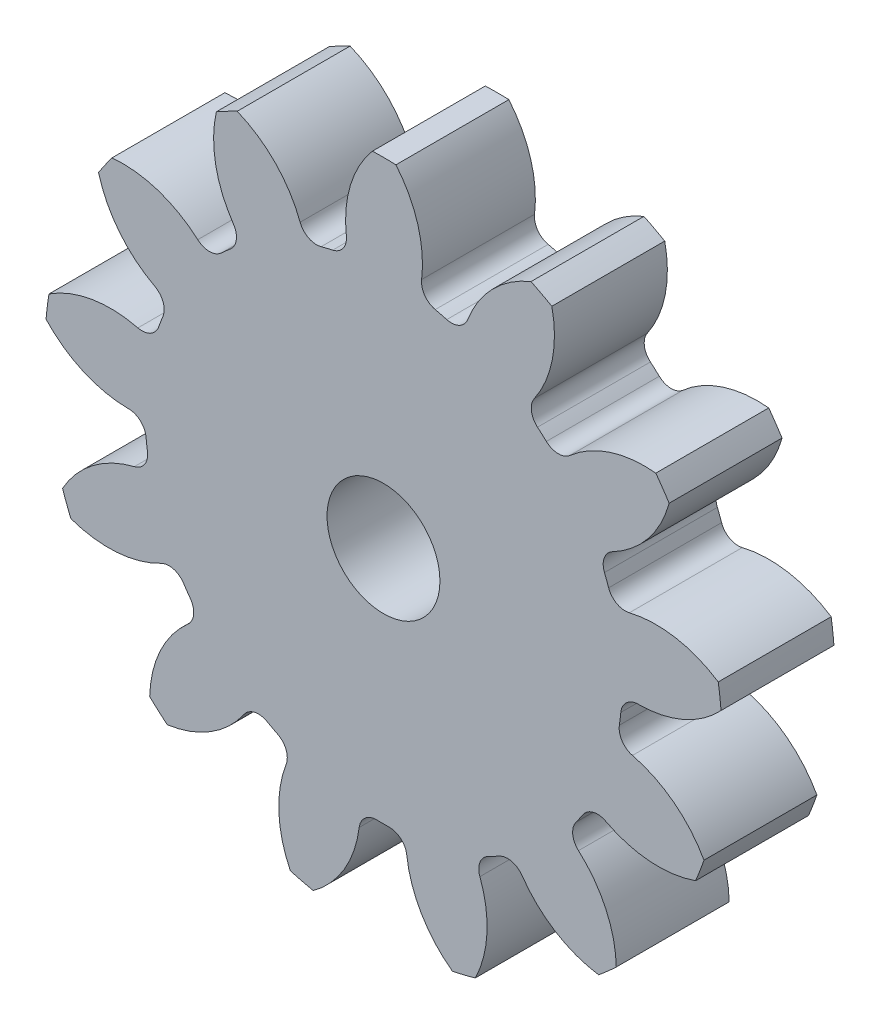
from build123d import *

# Parameters (mm, degrees)
SKETCH3_R         = 19.05
GEARBODY_DEPTH    = 6.35
TOOTHCUT_DEPTH    = 28.679008291
CIRPATTERN1_COUNT = 13
BOREDIA_R         = 3.175
BORE_DEPTH        = 12700


with BuildPart() as part:
    # Sketch3 → gearBody (new body)
    with BuildSketch(Plane.XY):
        Circle(SKETCH3_R)
    extrude(amount=GEARBODY_DEPTH)

    # Sketch2 → toothCut (cut, through all)
    with BuildSketch(Plane.XY):
        with BuildLine():
            ThreePointArc((13.264986348, -1.974948763), (13.310141874, -1.643292044), (13.347006495, -1.310611715))
            ThreePointArc((13.347006495, -1.310611715), (13.666143695, -0.676546319), (14.328555129, -0.421402101))
            ThreePointArc((14.328555129, -0.421402101), (17.301836936, 0.31404702), (19.586325857, 2.354243209))
            ThreePointArc((19.586325857, 2.354243209), (19.578654279, -2.417212912), (18.425600989, -7.04725832))
            ThreePointArc((18.425600989, -7.04725832), (16.705918728, -4.512700561), (14.000791176, -3.076185665))
            ThreePointArc((14.000791176, -3.076185665), (13.420325691, -2.667593815), (13.264986348, -1.974948763))
        make_face()
    toothcut = extrude(amount=TOOTHCUT_DEPTH, mode=Mode.SUBTRACT)

    # CirPattern1: toothCut ×13 about axis
    cirpattern1_axis = Axis((0, 0, 0), (0, 0, 1))
    for i in range(1, CIRPATTERN1_COUNT):
        add(toothcut.rotate(cirpattern1_axis, i * 360 / CIRPATTERN1_COUNT), mode=Mode.SUBTRACT)

    # boreDia → bore (cut, symmetric)
    with BuildSketch(Plane.XY):
        Circle(BOREDIA_R)
    extrude(amount=BORE_DEPTH, both=True, mode=Mode.SUBTRACT)


solid = part.part
